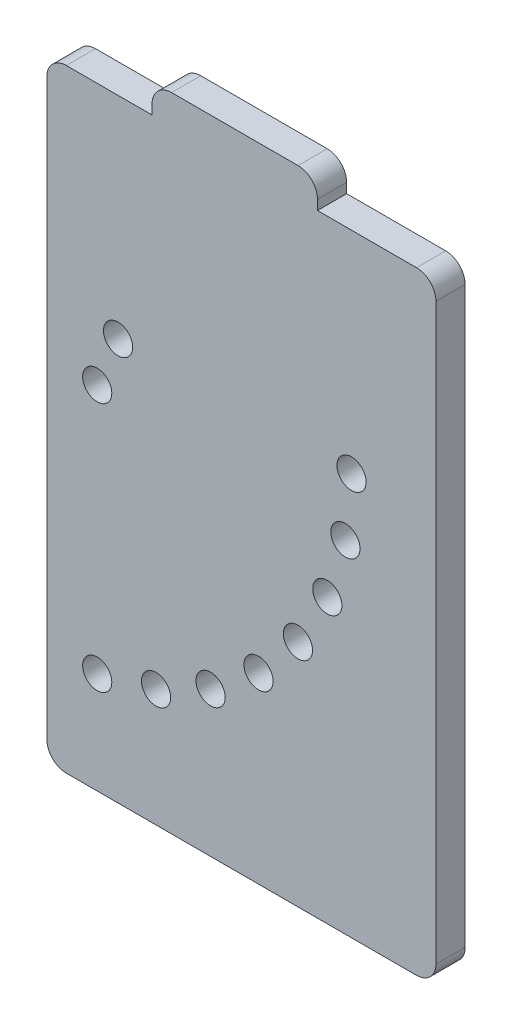
from build123d import *

# Parameters (mm, degrees)
SKETCH_1_R      = 1.5
SKETCH_1_W      = 17
SKETCH_1_H      = 3
EXTRUDE_1_DEPTH = 3
FILLET_1_R      = 2
FILLET_2_R      = 2


with BuildPart() as part:
    # 草图1 → 凸台-拉伸1 (new body)
    # profile 1 of 5: a face of its own
    with BuildSketch(Plane.XY):
        with BuildLine():
            Line((0, 10), (0, 7))
            ThreePointArc((0, 7), (24.26790473, 17.05209527), (34.32, 41.32))
            Line((34.32, 41.32), (34.32, 63))
            Line((34.32, 63), (4.32, 63))
            Line((4.32, 63), (4.32, 41.32))
            ThreePointArc((4.32, 41.32), (3.054701295, 38.265298705), (0, 37))
            Line((0, 37), (0, 34))
            Line((0, 34), (0, 22))
            Line((0, 22), (0, 10))
        make_face()
        with Locations((5.176021638, 10.430662034)):
            Circle(SKETCH_1_R, mode=Mode.SUBTRACT)
        with Locations((11.229544899, 12.082357801)):
            Circle(SKETCH_1_R, mode=Mode.SUBTRACT)
        with Locations((16.832334664, 14.907599318)):
            Circle(SKETCH_1_R, mode=Mode.SUBTRACT)
        with Locations((21.759505147, 18.792986533)):
            Circle(SKETCH_1_R, mode=Mode.SUBTRACT)
        with Locations((25.813288692, 23.582567072)):
            Circle(SKETCH_1_R, mode=Mode.SUBTRACT)
        with Locations((28.830973806, 29.08409589)):
            Circle(SKETCH_1_R, mode=Mode.SUBTRACT)
        with Locations((30.691436099, 35.076751631)):
            Circle(SKETCH_1_R, mode=Mode.SUBTRACT)
        with Locations((31.32, 41.32)):
            Circle(SKETCH_1_R, mode=Mode.SUBTRACT)
        with Locations((7.32, 41.32)):
            Circle(SKETCH_1_R, mode=Mode.SUBTRACT)
        with Locations((5.176021638, 36.143978362)):
            Circle(SKETCH_1_R, mode=Mode.SUBTRACT)
    # profile 2 of 5: a face of its own
    with BuildSketch(Plane.XY):
        with BuildLine():
            Line((0, 41.32), (0, 37))
            ThreePointArc((0, 37), (3.054701295, 38.265298705), (4.32, 41.32))
            Line((4.32, 41.32), (4.32, 63))
            Line((4.32, 63), (0, 63))
            Line((0, 63), (0, 41.32))
        make_face()
    # profile 3 of 5: a face of its own
    with BuildSketch(Plane.XY):
        with BuildLine():
            ThreePointArc((0, 7), (24.26790473, 17.05209527), (34.32, 41.32))
            Line((34.32, 41.32), (34.32, 63))
            Line((34.32, 63), (40, 63))
            Line((40, 63), (40, 0))
            Line((40, 0), (0, 0))
            Line((0, 0), (0, 7))
        make_face()
    # profile 4 of 5: a face of its own
    with BuildSketch(Plane.XY):
        with Locations((19.32, 64.5)):
            Rectangle(SKETCH_1_W, SKETCH_1_H)
    # profile 5 of 5: a face of its own
    with BuildSketch(Plane.XY):
        with BuildLine():
            ThreePointArc((34.32, 41.32), (24.26790473, 17.05209527), (0, 7))
            Line((0, 7), (0, 0))
            Line((0, 0), (40, 0))
            Line((40, 0), (40, 63))
            Line((40, 63), (34.32, 63))
            Line((34.32, 63), (34.32, 41.32))
        make_face()
    extrude(amount=EXTRUDE_1_DEPTH)

    # 圆角1
    fillet_1_edges = [part.edges().sort_by_distance(p)[0] for p in [
        (40, 63, 1.5),
        (40, 0, 1.5),
        (0, 0, 1.5),
        (0, 63, 1.5),
    ]]
    fillet(fillet_1_edges, radius=FILLET_1_R)

    # 圆角2
    fillet_2_edges = [part.edges().sort_by_distance(p)[0] for p in [
        (10.82, 66, 1.5),
        (27.82, 66, 1.5),
    ]]
    fillet(fillet_2_edges, radius=FILLET_2_R)


solid = part.part
